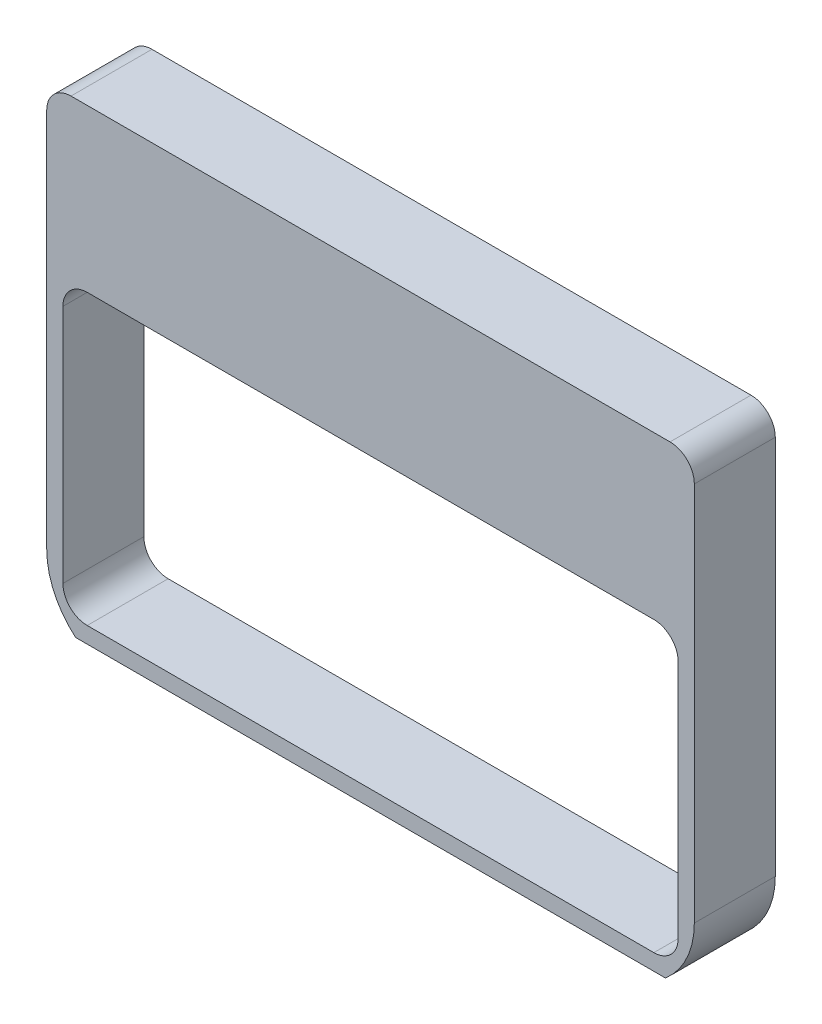
from build123d import *

# Parameters (mm, degrees)
RESSALTO_EXTRUS_O1_DEPTH = 10
CORTE_EXTRUS_O1_DEPTH    = 10


with BuildPart() as part:
    # Esboço1 → Ressalto-extrusão1 (new body)
    with BuildSketch(Plane.XY):
        with BuildLine():
            Line((-49.563885949, 93.398903013), (24.436114051, 93.398903013))
            ThreePointArc((24.436114051, 93.398903013), (26.557434395, 92.520223357), (27.436114051, 90.398903013))
            Line((27.436114051, 90.398903013), (27.436114051, 78.398903013))
            Line((27.436114051, 78.398903013), (27.436114051, 43.418903013))
            ThreePointArc((27.436114051, 43.418903013), (26.499191921, 39.192720396), (23.863990148, 35.758458582))
            Line((23.863990148, 35.758458582), (-48.991762046, 35.758458582))
            ThreePointArc((-48.991762046, 35.758458582), (-51.626963819, 39.192720396), (-52.563885949, 43.418903013))
            Line((-52.563885949, 43.418903013), (-52.563885949, 78.398903013))
            Line((-52.563885949, 78.398903013), (-52.563885949, 90.398903013))
            ThreePointArc((-52.563885949, 90.398903013), (-51.685206293, 92.520223357), (-49.563885949, 93.398903013))
        make_face()
    extrude(amount=RESSALTO_EXTRUS_O1_DEPTH)

    # Esboço2 → Corte-extrusão1 (cut)
    with BuildSketch(Plane(origin=(0, 0, 0), x_dir=(-1, 0, 0), z_dir=(0, 0, -1))):
        with BuildLine():
            Line((-22.436114051, 73.398903013), (47.563885949, 73.398903013))
            ThreePointArc((47.563885949, 73.398903013), (49.685206293, 72.520223357), (50.563885949, 70.398903013))
            Line((50.563885949, 70.398903013), (50.563885949, 40.758458582))
            ThreePointArc((50.563885949, 40.758458582), (49.685206293, 38.637138238), (47.563885949, 37.758458582))
            Line((47.563885949, 37.758458582), (-22.436114051, 37.758458582))
            ThreePointArc((-22.436114051, 37.758458582), (-24.557434395, 38.637138238), (-25.436114051, 40.758458582))
            Line((-25.436114051, 40.758458582), (-25.436114051, 70.398903013))
            ThreePointArc((-25.436114051, 70.398903013), (-24.557434395, 72.520223357), (-22.436114051, 73.398903013))
        make_face()
    extrude(amount=-CORTE_EXTRUS_O1_DEPTH, mode=Mode.SUBTRACT)


solid = part.part
